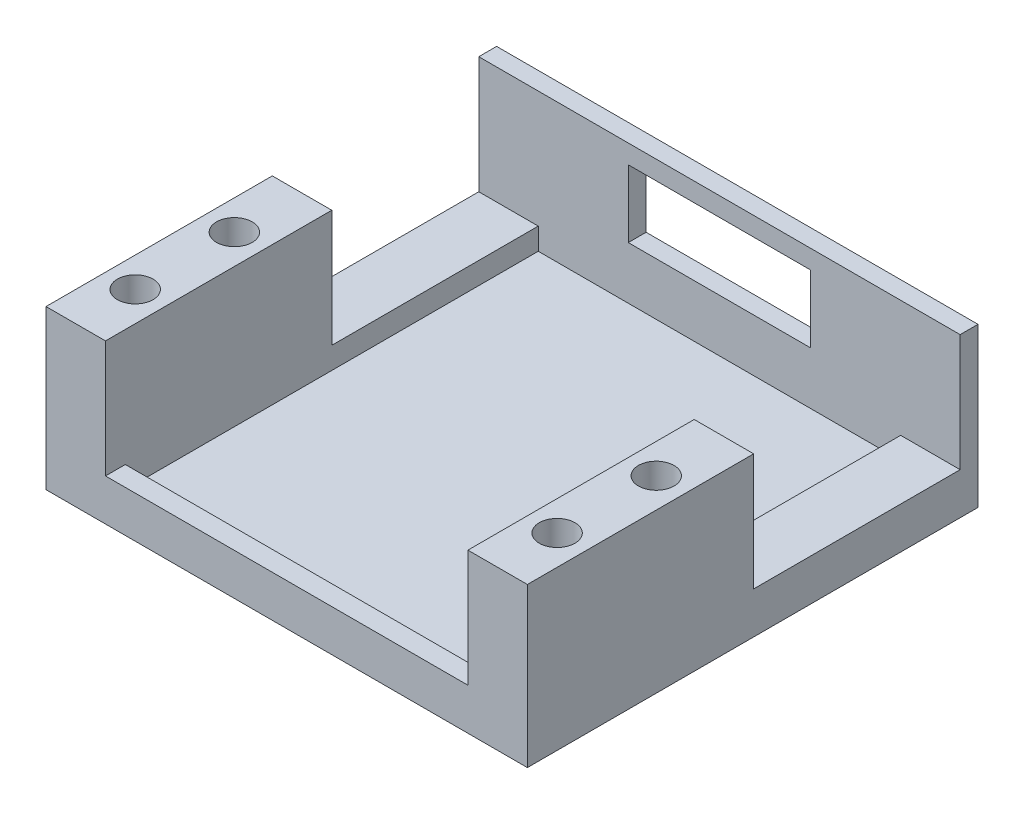
from build123d import *

# Parameters (mm, degrees)
USB_LIP_DEPTH                       = 1.55
BASE_START                          = -1.1
SKETCH1_3_W                         = 18.28
SKETCH1_3_H                         = 20.828
BASE_W_1_1MM_COMPONENT_OFFSET_DEPTH = 1
SKETCH1_4_W                         = 3
SKETCH1_4_H                         = 20.828
SIDES_DEPTH                         = 2.1
SKETCH2_W                           = 7.54
SKETCH2_H                           = 0.9
USB_SIDES_DEPTH                     = 3.4
SKETCH3_W                           = 24.28
SKETCH3_H                           = 0.9
USB_TOP_DEPTH                       = 0.95
SKETCH4_W                           = 3
SKETCH4_H                           = 11.414
SIDE_GUARDS_DEPTH                   = 5.9
SKETCH5_R                           = 0.9
MOUNT_HOLES_DEPTH                   = 32.447486132


with BuildPart() as part:
    # Sketch1 → USB Lip (new body)
    with BuildSketch(Plane(origin=(0, 0, 0), x_dir=(1, 0, 0), z_dir=(0, 1, 0))):
        Polygon((18.28, 20.828), (21.28, 20.828), (21.28, 21.728), (-3, 21.728), (-3, 20.828), (0, 20.828), align=None)
    extrude(amount=USB_LIP_DEPTH)



with BuildPart() as body_2:
    # Sketch1<3> → Base w/ 1.1mm component offset (new body)
    with BuildSketch(Plane(origin=(0, 0, 0), x_dir=(1, 0, 0), z_dir=(0, 1, 0)).offset(BASE_START)):
        with Locations((9.14, 10.414)):
            Rectangle(SKETCH1_3_W, SKETCH1_3_H)
    extrude(amount=-BASE_W_1_1MM_COMPONENT_OFFSET_DEPTH)


with BuildPart() as part_1:
    add(part.part)

    add(body_2.part)  # Sides merges body 2
    # Sketch1<4> → Sides (add)
    with BuildSketch(Plane(origin=(0, 0, 0), x_dir=(1, 0, 0), z_dir=(0, 1, 0))):
        with Locations((-1.5, 10.414)):
            Rectangle(SKETCH1_4_W, SKETCH1_4_H)
        Polygon((21.28, 0), (21.28, -1), (-3, -1), (-3, 0), (0, 0), (18.28, 0), align=None)
        with Locations((19.78, 10.414)):
            Rectangle(SKETCH1_4_W, SKETCH1_4_H)
        Polygon((18.28, 20.828), (21.28, 20.828), (21.28, 21.728), (-3, 21.728), (-3, 20.828), (0, 20.828), align=None)
    extrude(amount=-SIDES_DEPTH)

    # Sketch2 → USB Sides (add)
    with BuildSketch(Plane(origin=(0, 1.55, 0), x_dir=(1, 0, 0), z_dir=(0, 1, 0))):
        with Locations((0.77, 21.278)):
            Rectangle(SKETCH2_W, SKETCH2_H)
        with Locations((17.51, 21.278)):
            Rectangle(SKETCH2_W, SKETCH2_H)
    extrude(amount=USB_SIDES_DEPTH)

    # Sketch3 → USB Top (add)
    with BuildSketch(Plane(origin=(0, 4.95, 0), x_dir=(1, 0, 0), z_dir=(0, 1, 0))):
        with Locations((9.14, 21.278)):
            Rectangle(SKETCH3_W, SKETCH3_H)
    extrude(amount=USB_TOP_DEPTH)

    # Sketch4 → Side Guards (add)
    with BuildSketch(Plane(origin=(0, 0, 0), x_dir=(1, 0, 0), z_dir=(0, 1, 0))):
        with Locations((-1.5, 4.707)):
            Rectangle(SKETCH4_W, SKETCH4_H)
        with Locations((19.78, 4.707)):
            Rectangle(SKETCH4_W, SKETCH4_H)
    extrude(amount=SIDE_GUARDS_DEPTH)

    # Sketch5 → Mount Holes (cut, through all)
    with BuildSketch(Plane(origin=(0, 5.9, 0), x_dir=(1, 0, 0), z_dir=(0, 1, 0))):
        with Locations(Location((-1.5, 2, 0), (0, 0, 270))):
            Circle(SKETCH5_R)
        with Locations(Location((19.78, 2, 0), (0, 0, 270))):
            Circle(SKETCH5_R)
        with Locations(Location((-1.5, 7, 0), (0, 0, 270))):
            Circle(SKETCH5_R)
        with Locations(Location((19.78, 7, 0), (0, 0, 270))):
            Circle(SKETCH5_R)
    extrude(amount=-MOUNT_HOLES_DEPTH, mode=Mode.SUBTRACT)


solid = part_1.part
